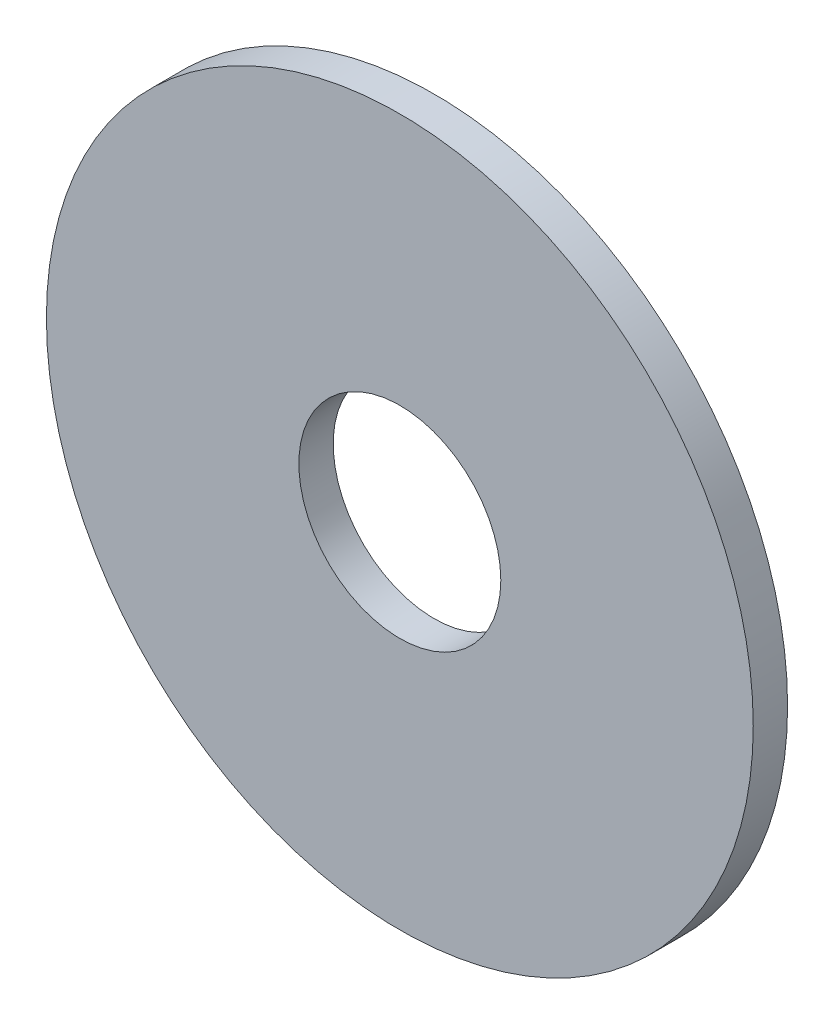
from build123d import *

# Parameters (mm, degrees)
SKETCH1_R           = 17.5
SKETCH1_R_2         = 5
BOSS_EXTRUDE1_DEPTH = 1.7


with BuildPart() as part:
    # Sketch1 → Boss-Extrude1 (new body)
    with BuildSketch(Plane.XY):
        Circle(SKETCH1_R)
        Circle(SKETCH1_R_2, mode=Mode.SUBTRACT)
    extrude(amount=BOSS_EXTRUDE1_DEPTH)


solid = part.part
